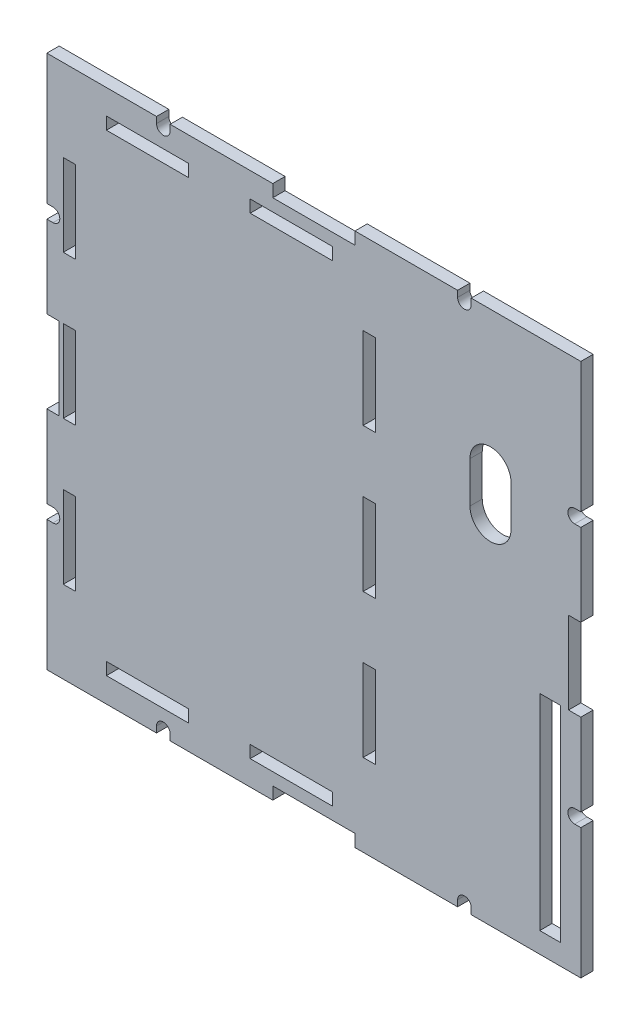
from build123d import *

# Parameters (mm, degrees)
SKETCH1_W           = 20
SKETCH1_H           = 3
SKETCH1_W_2         = 3
SKETCH1_H_2         = 20
SKETCH1_W_3         = 5
SKETCH1_H_3         = 50
BOSS_EXTRUDE1_DEPTH = 3


with BuildPart() as part:
    # Sketch1 → Boss-Extrude1 (new body)
    with BuildSketch(Plane.XY):
        with BuildLine():
            Line((10, -62), (10, -65))
            Line((10, -65), (35, -65))
            Line((35, -65), (35, -63.5))
            ThreePointArc((35, -63.5), (36.65, -61.85), (38.3, -63.5))
            Line((38.3, -63.5), (38.3, -65))
            Line((38.3, -65), (65, -65))
            Line((65, -65), (65, -33.3))
            Line((65, -33.3), (63.5, -33.3))
            ThreePointArc((63.5, -33.3), (61.85, -31.65), (63.5, -30))
            Line((63.5, -30), (65, -30))
            Line((65, -30), (65, -10))
            Line((65, -10), (62, -10))
            Line((62, -10), (62, 10))
            Line((62, 10), (65, 10))
            Line((65, 10), (65, 30))
            Line((65, 30), (63.5, 30))
            ThreePointArc((63.5, 30), (61.85, 31.65), (63.5, 33.3))
            Line((63.5, 33.3), (65, 33.3))
            Line((65, 33.3), (65, 65))
            Line((65, 65), (38.3, 65))
            Line((38.3, 65), (38.3, 63.5))
            ThreePointArc((38.3, 63.5), (36.65, 61.85), (35, 63.5))
            Line((35, 63.5), (35, 65))
            Line((35, 65), (10, 65))
            Line((10, 65), (10, 62))
            Line((10, 62), (-10, 62))
            Line((-10, 62), (-10, 65))
            Line((-10, 65), (-35, 65))
            Line((-35, 65), (-35, 63.5))
            ThreePointArc((-35, 63.5), (-36.65, 61.85), (-38.3, 63.5))
            Line((-38.3, 63.5), (-38.3, 65))
            Line((-38.3, 65), (-65, 65))
            Line((-65, 65), (-65, 33.3))
            Line((-65, 33.3), (-63.5, 33.3))
            ThreePointArc((-63.5, 33.3), (-61.85, 31.65), (-63.5, 30))
            Line((-63.5, 30), (-65, 30))
            Line((-65, 30), (-65, 10))
            Line((-65, 10), (-62, 10))
            Line((-62, 10), (-62, -10))
            Line((-62, -10), (-65, -10))
            Line((-65, -10), (-65, -30))
            Line((-65, -30), (-63.5, -30))
            ThreePointArc((-63.5, -30), (-61.85, -31.65), (-63.5, -33.3))
            Line((-63.5, -33.3), (-65, -33.3))
            Line((-65, -33.3), (-65, -65))
            Line((-65, -65), (-38.3, -65))
            Line((-38.3, -65), (-38.3, -63.5))
            ThreePointArc((-38.3, -63.5), (-36.65, -61.85), (-35, -63.5))
            Line((-35, -63.5), (-35, -65))
            Line((-35, -65), (-10, -65))
            Line((-10, -65), (-10, -62))
            Line((-10, -62), (10, -62))
        make_face()
        with Locations((-40.5, -57.5)):
            Rectangle(SKETCH1_W, SKETCH1_H, mode=Mode.SUBTRACT)
        with Locations((-59.5, -35)):
            Rectangle(SKETCH1_W_2, SKETCH1_H_2, mode=Mode.SUBTRACT)
        with Locations((-5.5, -57.5)):
            Rectangle(SKETCH1_W, SKETCH1_H, mode=Mode.SUBTRACT)
        with Locations((13.5, -35)):
            Rectangle(SKETCH1_W_2, SKETCH1_H_2, mode=Mode.SUBTRACT)
        with Locations((57.5, -35)):
            Rectangle(SKETCH1_W_3, SKETCH1_H_3, mode=Mode.SUBTRACT)
        with Locations((-59.5, 0)):
            Rectangle(SKETCH1_W_2, SKETCH1_H_2, mode=Mode.SUBTRACT)
        with Locations((-59.5, 35)):
            Rectangle(SKETCH1_W_2, SKETCH1_H_2, mode=Mode.SUBTRACT)
        with Locations((-40.5, 57.5)):
            Rectangle(SKETCH1_W, SKETCH1_H, mode=Mode.SUBTRACT)
        with Locations((-5.5, 57.5)):
            Rectangle(SKETCH1_W, SKETCH1_H, mode=Mode.SUBTRACT)
        with Locations((13.5, 0)):
            Rectangle(SKETCH1_W_2, SKETCH1_H_2, mode=Mode.SUBTRACT)
        with BuildLine():
            ThreePointArc((38, 31), (43, 36), (48, 31))
            Line((48, 31), (48, 21))
            ThreePointArc((48, 21), (43, 16), (38, 21))
            Line((38, 21), (38, 31))
        make_face(mode=Mode.SUBTRACT)
        with Locations((13.5, 35)):
            Rectangle(SKETCH1_W_2, SKETCH1_H_2, mode=Mode.SUBTRACT)
    extrude(amount=BOSS_EXTRUDE1_DEPTH)


solid = part.part
